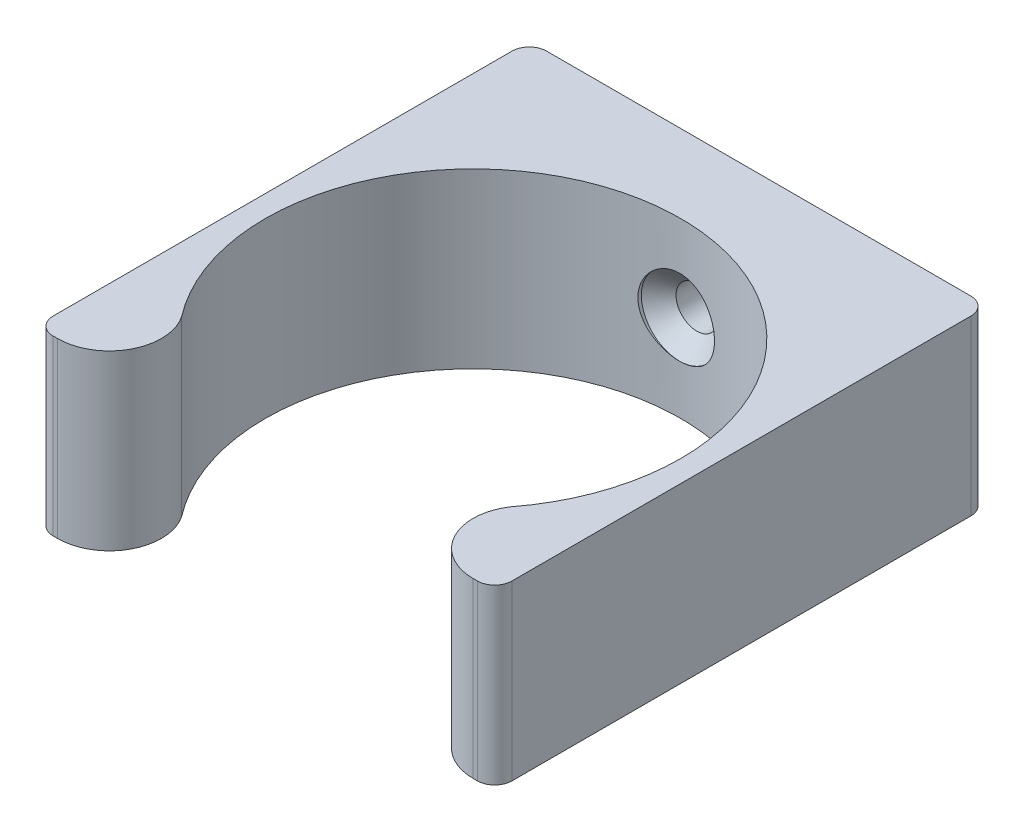
from build123d import *

# Parameters (mm, degrees)
BOSS_EXTRUDE1_DEPTH                             = 10
CSK_FOR_M2_FLAT_HEAD_MACHINE_SCREW1_D           = 2.4
CSK_FOR_M2_FLAT_HEAD_MACHINE_SCREW1_CSINK_D     = 4.4
CSK_FOR_M2_FLAT_HEAD_MACHINE_SCREW1_CSINK_ANGLE = 90


with BuildPart() as part:
    # Sketch1 → Boss-Extrude1 (new body)
    with BuildSketch(Plane(origin=(0, 0, 0), x_dir=(1, 0, 0), z_dir=(0, 1, 0))):
        with BuildLine():
            Line((12.25, -12), (12, -12))
            ThreePointArc((12, -12), (9.349555065, -10.408922304), (9.507567542, -7.321622732))
            ThreePointArc((9.507567542, -7.321622732), (0, 12), (-9.507567542, -7.321622732))
            ThreePointArc((-9.507567542, -7.321622732), (-9.349555065, -10.408922304), (-12, -12))
            Line((-12, -12), (-12.25, -12))
            ThreePointArc((-12.25, -12), (-12.957106781, -11.707106781), (-13.25, -11))
            Line((-13.25, -11), (-13.25, 15.5))
            ThreePointArc((-13.25, 15.5), (-12.957106781, 16.207106781), (-12.25, 16.5))
            Line((-12.25, 16.5), (12.25, 16.5))
            ThreePointArc((12.25, 16.5), (12.957106781, 16.207106781), (13.25, 15.5))
            Line((13.25, 15.5), (13.25, -11))
            ThreePointArc((13.25, -11), (12.957106781, -11.707106781), (12.25, -12))
        make_face()
    extrude(amount=BOSS_EXTRUDE1_DEPTH)

    # CSK for M2 Flat Head Machine Screw1 (through all)
    with Locations(Plane(origin=(-0.06607942, 5.031445439, -11.999818062), x_dir=(0.999984838462, 0, -0.005506618355), z_dir=(0.005506618355, 0, 0.999984838462))):
        with Locations((0, 0)):
            CounterSinkHole(CSK_FOR_M2_FLAT_HEAD_MACHINE_SCREW1_D / 2, CSK_FOR_M2_FLAT_HEAD_MACHINE_SCREW1_CSINK_D / 2, counter_sink_angle=CSK_FOR_M2_FLAT_HEAD_MACHINE_SCREW1_CSINK_ANGLE)


solid = part.part
